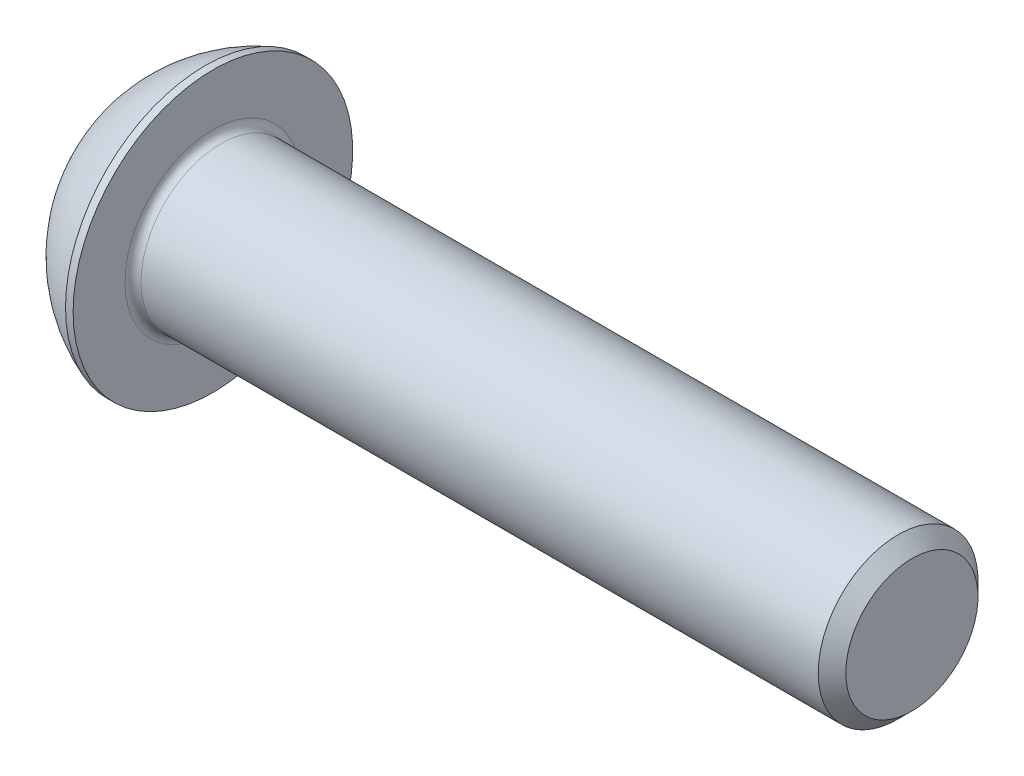
from build123d import *

# Parameters (mm, degrees)
FILLET1_R   = 0.4
HEX_2_DEPTH = 2.6


with BuildPart() as part:
    # BodySke → BaseBody (revolve)
    with BuildSketch(Plane.XY, mode=Mode.PRIVATE) as basebody_sk:
        with BuildLine():
            Line((39.4, 0), (39.4, 3.3095))
            Line((39.4, 3.3095), (38.7095, 4))
            Line((38.7095, 4), (4.4, 4))
            Line((4.4, 4), (4.4, 7))
            Line((4.4, 7), (4.02, 7))
            ThreePointArc((4.02, 7), (1.686451133, 5.621618984), (0, 3.5))
            Line((0, 3.5), (0, 0))
            Line((0, 0), (39.4, 0))
        make_face()
    revolve(basebody_sk.sketch.rotate(Axis((0, 0, 0), (1, 0, 0)), 90), axis=Axis((0, 0, 0), (1, 0, 0)))

    # Fillet1
    fillet1_edges = [part.edges().sort_by_distance(p)[0] for p in [
        (4.4, 0, -4),
    ]]
    fillet(fillet1_edges, radius=FILLET1_R)

    # Sketch2 → PreBroach (revolve, cut)
    with BuildSketch(Plane.XY, mode=Mode.PRIVATE) as prebroach_sk:
        Polygon((0, 2.5), (2.6, 2.5), (4.043375673, 0), (0, 0), align=None)
    revolve(prebroach_sk.sketch.rotate(Axis((0, 0, 0), (1, 0, 0)), 90), axis=Axis((0, 0, 0), (1, 0, 0)), mode=Mode.SUBTRACT)

    # Sketch3 → Hex 2 (cut)
    with BuildSketch(Plane(origin=(0, 0, 0), x_dir=(0, 0, -1), z_dir=(1, 0, 0))):
        Polygon((-2.5, -1.443375673), (-2.5, 1.443375673), (0, 2.886751346), (2.5, 1.443375673), (2.5, -1.443375673), (0, -2.886751346), align=None)
    extrude(amount=HEX_2_DEPTH, mode=Mode.SUBTRACT)


solid = part.part
